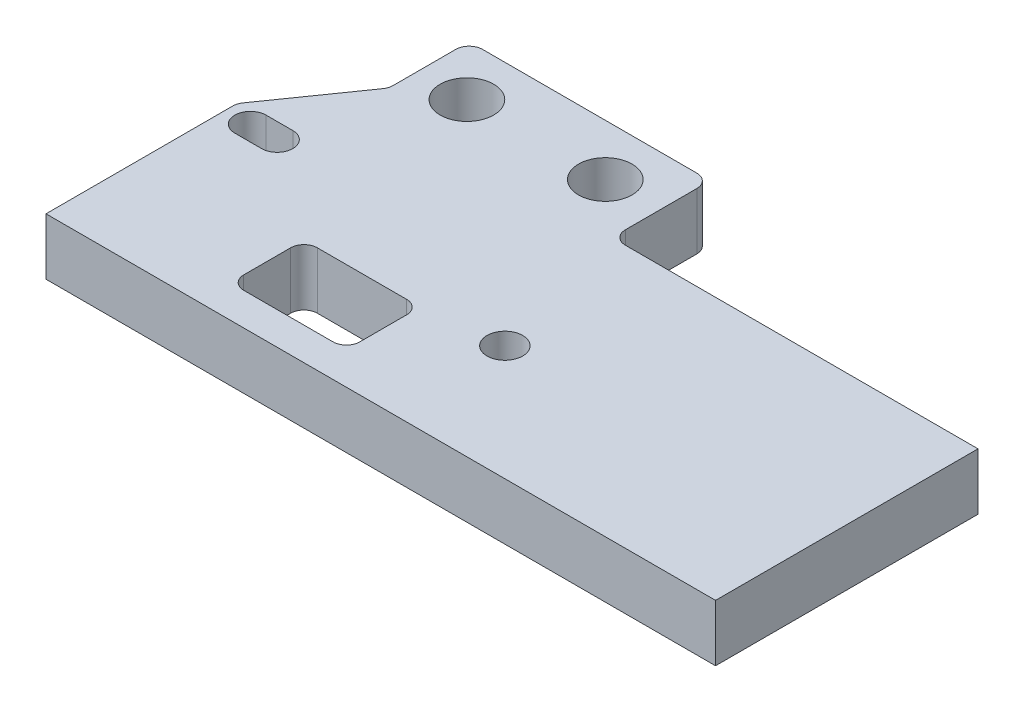
from build123d import *

# Parameters (mm, degrees)
SKETCH1_R           = 2
SKETCH1_R_2         = 3
SKETCH1_W           = 13
SKETCH1_H           = 8.25
BOSS_EXTRUDE1_DEPTH = 6.35
FILLET1_R           = 1.5
SKETCH2_W           = 82.327825706
SKETCH2_H           = 14.458254131
CUT_EXTRUDE1_DEPTH  = 51
SKETCH3_W           = 51.5
SKETCH3_H           = 6.35
BOSS_EXTRUDE2_DEPTH = 25
SKETCH4_W           = 84.929028447
SKETCH4_H           = 25.885902506
CUT_EXTRUDE2_DEPTH  = 90
SKETCH5_W           = 0.1
SKETCH5_H           = 6.35
CUT_EXTRUDE3_DEPTH  = 90
SKETCH6_W           = 81.24526446
SKETCH6_H           = 21.013173112
CUT_EXTRUDE4_DEPTH  = 90


with BuildPart() as part:
    # Sketch1 → Boss-Extrude1 (new body)
    with BuildSketch(Plane(origin=(0, 0, 0), x_dir=(1, 0, 0), z_dir=(0, 1, 0))):
        Polygon((38, 0), (38, 5), (58, 5), (58, 0), (96, 0), (96, 48.5), (89, 58.5), (89, 67.5), (62, 67.5), (62, 56.5), (34, 56.5), (34, 67.5), (7, 67.5), (7, 58.5), (0, 48.5), (0, 0), align=None)
        with Locations(Location((38.5, 40, 0), (0, 0, 270))):
            Circle(SKETCH1_R, mode=Mode.SUBTRACT)
        with Locations(Location((38.5, 22, 0), (0, 0, 270))):
            Circle(SKETCH1_R, mode=Mode.SUBTRACT)
        with Locations(Location((57.5, 22, 0), (0, 0, 90))):
            Circle(SKETCH1_R, mode=Mode.SUBTRACT)
        with Locations(Location((57.5, 40, 0), (0, 0, 90))):
            Circle(SKETCH1_R, mode=Mode.SUBTRACT)
        with Locations(Location((12.5, 61.75, 0), (0, 0, 270))):
            Circle(SKETCH1_R_2, mode=Mode.SUBTRACT)
        with Locations(Location((28, 61.75, 0), (0, 0, 270))):
            Circle(SKETCH1_R_2, mode=Mode.SUBTRACT)
        with Locations(Location((68, 61.75, 0), (0, 0, 90))):
            Circle(SKETCH1_R_2, mode=Mode.SUBTRACT)
        with Locations(Location((83.5, 61.75, 0), (0, 0, 90))):
            Circle(SKETCH1_R_2, mode=Mode.SUBTRACT)
        with Locations((72.5, 18.625)):
            Rectangle(SKETCH1_W, SKETCH1_H, mode=Mode.SUBTRACT)
        with Locations((23.5, 34.875)):
            Rectangle(SKETCH1_W, SKETCH1_H, mode=Mode.SUBTRACT)
        with Locations((23.5, 18.625)):
            Rectangle(SKETCH1_W, SKETCH1_H, mode=Mode.SUBTRACT)
        with Locations((72.5, 34.875)):
            Rectangle(SKETCH1_W, SKETCH1_H, mode=Mode.SUBTRACT)
        with BuildLine():
            Line((2.75, 11.75), (5.75, 11.75))
            ThreePointArc((5.75, 11.75), (7.5, 10), (5.75, 8.25))
            Line((5.75, 8.25), (2.75, 8.25))
            ThreePointArc((2.75, 8.25), (1, 10), (2.75, 11.75))
        make_face(mode=Mode.SUBTRACT)
        with BuildLine():
            Line((93.25, 8.25), (90.25, 8.25))
            ThreePointArc((90.25, 8.25), (88.5, 10), (90.25, 11.75))
            Line((90.25, 11.75), (93.25, 11.75))
            ThreePointArc((93.25, 11.75), (95, 10), (93.25, 8.25))
        make_face(mode=Mode.SUBTRACT)
        with BuildLine():
            Line((93.25, 45.5), (90.25, 45.5))
            ThreePointArc((90.25, 45.5), (88.5, 47.25), (90.25, 49))
            Line((90.25, 49), (93.25, 49))
            ThreePointArc((93.25, 49), (95, 47.25), (93.25, 45.5))
        make_face(mode=Mode.SUBTRACT)
        with BuildLine():
            Line((2.75, 49), (5.75, 49))
            ThreePointArc((5.75, 49), (7.5, 47.25), (5.75, 45.5))
            Line((5.75, 45.5), (2.75, 45.5))
            ThreePointArc((2.75, 45.5), (1, 47.25), (2.75, 49))
        make_face(mode=Mode.SUBTRACT)
    extrude(amount=BOSS_EXTRUDE1_DEPTH)

    # Fillet1
    fillet1_edges = [part.edges().sort_by_distance(p)[0] for p in [
        (0, 3.175, -48.5),
        (7, 3.175, -58.5),
        (7, 3.175, -67.5),
        (34, 3.175, -67.5),
        (34, 3.175, -56.5),
        (62, 3.175, -56.5),
        (62, 3.175, -67.5),
        (89, 3.175, -67.5),
        (89, 3.175, -58.5),
        (96, 3.175, -48.5),
        (96, 3.175, 0),
        (58, 3.175, 0),
        (58, 3.175, -5),
        (38, 3.175, -5),
        (38, 3.175, 0),
        (0, 3.175, 0),
        (17, 3.175, -39),
        (17, 3.175, -30.75),
        (30, 3.175, -30.75),
        (30, 3.175, -39),
        (17, 3.175, -22.75),
        (17, 3.175, -14.5),
        (30, 3.175, -14.5),
        (30, 3.175, -22.75),
        (79, 3.175, -14.5),
        (79, 3.175, -22.75),
        (66, 3.175, -22.75),
        (66, 3.175, -14.5),
        (79, 3.175, -30.75),
        (79, 3.175, -39),
        (66, 3.175, -39),
        (66, 3.175, -30.75),
    ]]
    fillet(fillet1_edges, radius=FILLET1_R)

    # Sketch2 → Cut-Extrude1 (cut)
    with BuildSketch(Plane(origin=(48, 0, 0), x_dir=(0, 0, -1), z_dir=(1, 0, 0))):
        with Locations((33.293792952, 1.315835649)):
            Rectangle(SKETCH2_W, SKETCH2_H)
    extrude(amount=CUT_EXTRUDE1_DEPTH, mode=Mode.SUBTRACT)

    # Sketch3 → Boss-Extrude2 (add)
    with BuildSketch(Plane(origin=(48, 0, 0), x_dir=(0, 0, -1), z_dir=(1, 0, 0))):
        with Locations((30.75, 3.175)):
            Rectangle(SKETCH3_W, SKETCH3_H)
    extrude(amount=BOSS_EXTRUDE2_DEPTH)

    # Mirror1: part across plane


with BuildPart() as part_1:
    add(part.part)
    add(part.part.mirror(Plane(origin=(73, 0, 0), x_dir=(0, 0, 1), z_dir=(1, 0, 0))))

    # Sketch4 → Cut-Extrude2 (cut)
    with BuildSketch(Plane(origin=(75, 0, 0), x_dir=(0, 0, -1), z_dir=(1, 0, 0))):
        with Locations((34.029781947, 1.13903014)):
            Rectangle(SKETCH4_W, SKETCH4_H)
    extrude(amount=CUT_EXTRUDE2_DEPTH, mode=Mode.SUBTRACT)

    # Sketch5 → Cut-Extrude3 (cut)
    with BuildSketch(Plane(origin=(75, 0, 0), x_dir=(0, 0, -1), z_dir=(1, 0, 0))):
        with Locations((27.05, 3.175)):
            Rectangle(SKETCH5_W, SKETCH5_H)
    extrude(amount=-CUT_EXTRUDE3_DEPTH, mode=Mode.SUBTRACT)


with BuildPart() as cut_extrude3_piece_1:
    # of the separate pieces the step leaves, piece 1, a body of its own (cut_extrude3_pieces)
    add(part_1.part.solids().sort_by_distance((0, 0, -48.027166654))[0])


with BuildPart() as cut_extrude3_piece_2:
    # of the separate pieces the step leaves, piece 2, a body of its own (cut_extrude3_pieces)
    add(part_1.part.solids().sort_by_distance((38, 0, -1.5))[0])

    # Sketch6 → Cut-Extrude4 (cut)
    with BuildSketch(Plane(origin=(0, 0, -27), x_dir=(-1, 0, 0), z_dir=(0, 0, -1))):
        with Locations((-35.926138856, 1.728749219)):
            Rectangle(SKETCH6_W, SKETCH6_H)
    extrude(amount=-CUT_EXTRUDE4_DEPTH, mode=Mode.SUBTRACT)


solid = cut_extrude3_piece_1.part
